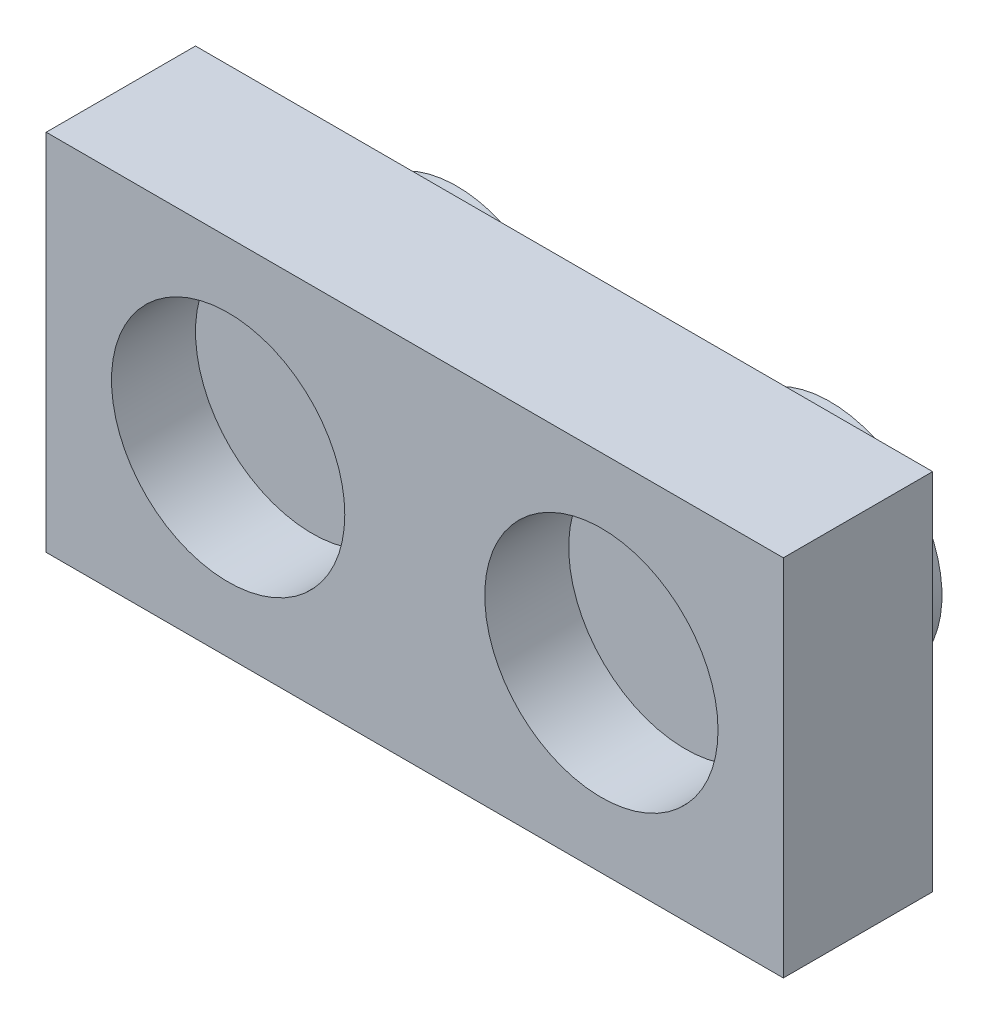
from build123d import *

# Parameters (mm, degrees)
SKETCH_1_W          = 15.8
SKETCH_1_H          = 7.8
EXTRUDE_1_DEPTH     = 3.2
SKETCH_2_R          = 2.4
EXTRUDE_2_DEPTH     = 1.7
SKETCH_3_R          = 2.5
CUT_EXTRUDE_1_DEPTH = 1.8


with BuildPart() as part:
    # Эскиз1 → Бобышка-Вытянуть1 (new body)
    with BuildSketch(Plane.XY):
        Rectangle(SKETCH_1_W, SKETCH_1_H)
    extrude(amount=EXTRUDE_1_DEPTH)

    # Эскиз2 → Бобышка-Вытянуть2 (add)
    with BuildSketch(Plane(origin=(0, 0, 0), x_dir=(-1, 0, 0), z_dir=(0, 0, -1))):
        with Locations((-4, 0)):
            Circle(SKETCH_2_R)
        with Locations((4, 0)):
            Circle(SKETCH_2_R)
    extrude(amount=EXTRUDE_2_DEPTH)

    # Эскиз3 → Вырез-Вытянуть1 (cut)
    with BuildSketch(Plane.XY.offset(3.2)):
        with Locations((-4, 0)):
            Circle(SKETCH_3_R)
        with Locations((4, 0)):
            Circle(SKETCH_3_R)
    extrude(amount=-CUT_EXTRUDE_1_DEPTH, mode=Mode.SUBTRACT)


solid = part.part
